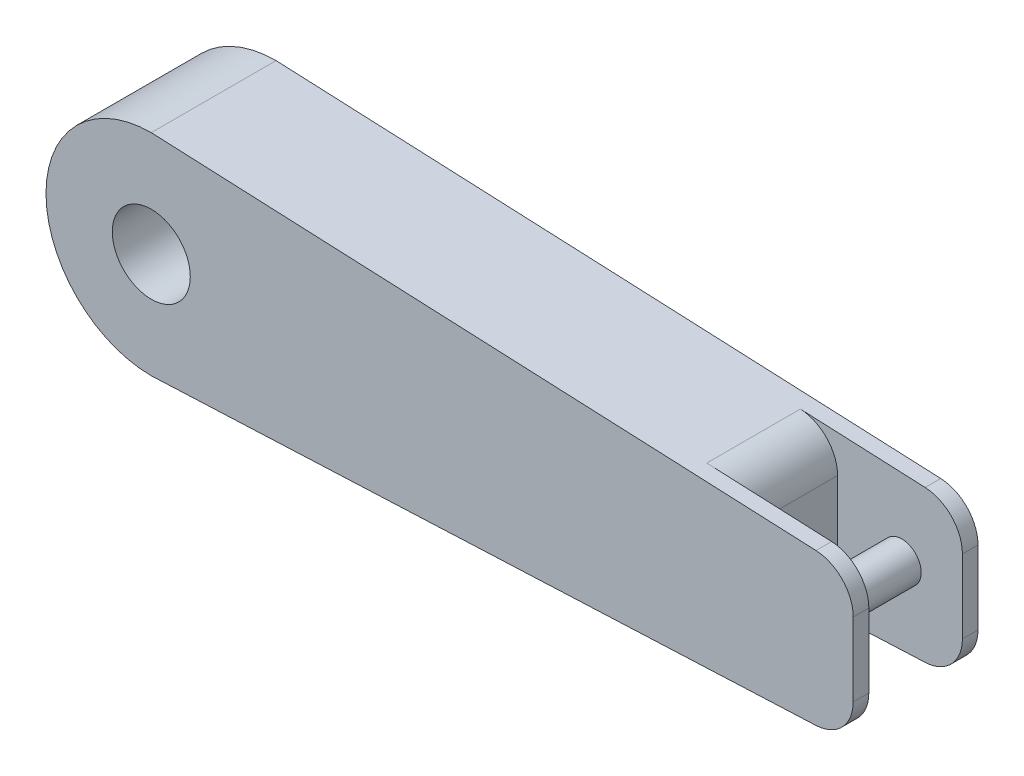
from build123d import *

# Parameters (mm, degrees)
SKETCH1_R           = 25
BOSS_EXTRUDE1_DEPTH = 80
CUT_EXTRUDE1_DEPTH  = 80
SKETCH4_W           = 60
SKETCH4_H           = 145
CUT_EXTRUDE2_DEPTH  = 80
FILLET1_R           = 25
FILLET2_R           = 25
SKETCH5_R           = 12.5
BOSS_EXTRUDE2_DEPTH = 60


with BuildPart() as part:
    # Sketch1 → Boss-Extrude1 (new body)
    with BuildSketch(Plane.XY):
        with BuildLine():
            Line((-151.599161153, -67.5), (298.400838847, -67.5))
            Line((298.400838847, -67.5), (298.400838847, 67.5))
            Line((298.400838847, 67.5), (-151.599161153, 67.5))
            ThreePointArc((-151.599161153, 67.5), (-219.099161153, 0), (-151.599161153, -67.5))
        make_face()
        with Locations((-151.599161153, 0)):
            Circle(SKETCH1_R, mode=Mode.SUBTRACT)
    extrude(amount=BOSS_EXTRUDE1_DEPTH)

    # Sketch3 → Cut-Extrude1 (cut)
    with BuildSketch(Plane.XY.offset(80)):
        Polygon((298.400838847, 67.5), (-151.599161153, 67.5), (298.400838847, 47.5), align=None)
        Polygon((298.400838847, -67.5), (298.400838847, -47.5), (-151.599161153, -67.5), align=None)
    extrude(amount=-CUT_EXTRUDE1_DEPTH, mode=Mode.SUBTRACT)

    # Sketch4 → Cut-Extrude2 (cut)
    with BuildSketch(Plane(origin=(298.400838847, 0, 0), x_dir=(0, 0, -1), z_dir=(1, 0, 0))):
        with Locations((-40, 0)):
            Rectangle(SKETCH4_W, SKETCH4_H)
    extrude(amount=-CUT_EXTRUDE2_DEPTH, mode=Mode.SUBTRACT)

    # Fillet1
    fillet1_edges = [part.edges().sort_by_distance(p)[0] for p in [
        (218.400838847, -51.055555556, 40),
        (218.400838847, 51.055555556, 40),
    ]]
    fillet(fillet1_edges, radius=FILLET1_R)

    # Fillet2
    fillet2_edges = [part.edges().sort_by_distance(p)[0] for p in [
        (298.400838847, 47.5, 5),
        (298.400838847, -47.5, 5),
        (298.400838847, -47.5, 75),
        (298.400838847, 47.5, 75),
    ]]
    fillet(fillet2_edges, radius=FILLET2_R)

    # Sketch5 → Boss-Extrude2 (add)
    with BuildSketch(Plane.XY.offset(10)):
        with Locations(Location((259.510854188, 0, 0), (0, 0, 90))):
            Circle(SKETCH5_R)
    extrude(amount=BOSS_EXTRUDE2_DEPTH)


solid = part.part
